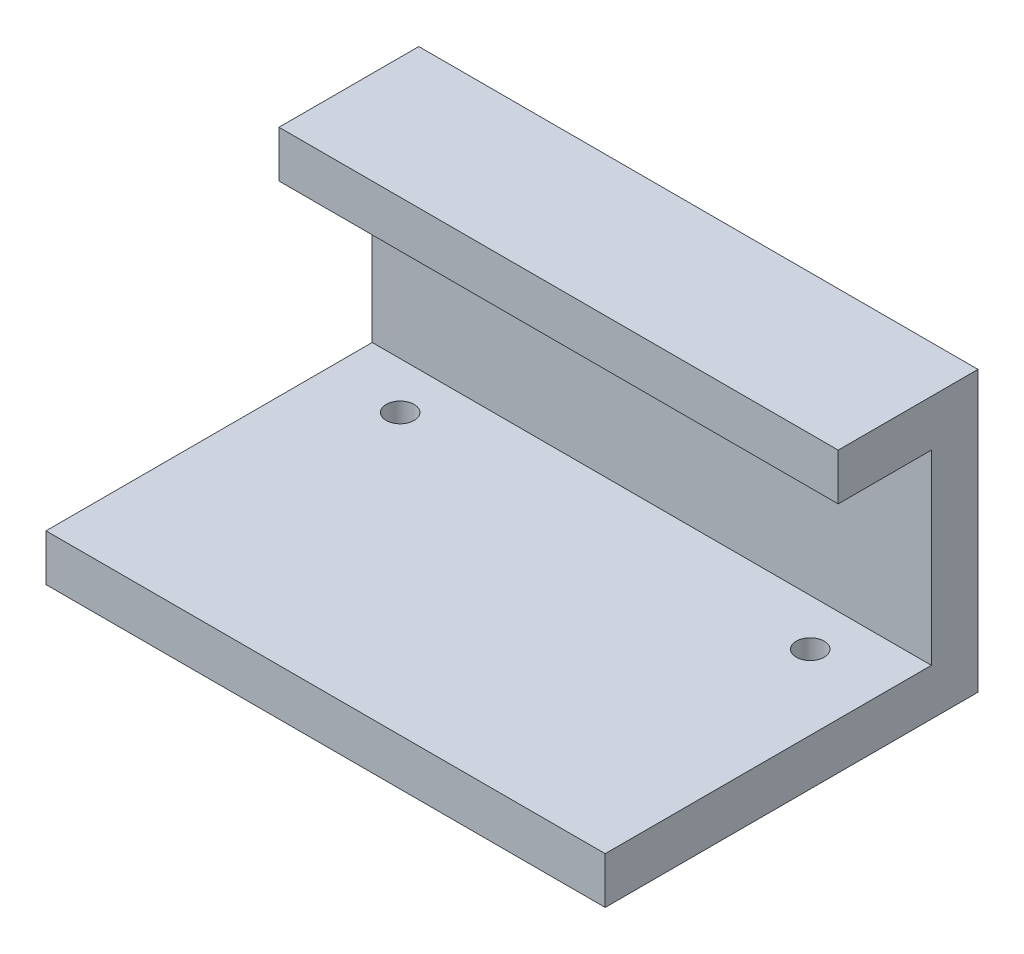
from build123d import *

# Parameters (mm, degrees)
SKETCH_1_W          = 60
SKETCH_1_H          = 40
EXTRUDE_1_DEPTH     = 5
SKETCH_3_W          = 60
SKETCH_3_H          = 5
EXTRUDE_2_DEPTH     = 25
SKETCH_4_W          = 60
SKETCH_4_H          = 5
EXTRUDE_3_DEPTH     = 10
SKETCH_5_R          = 1.5
CUT_EXTRUDE_1_DEPTH = 5


with BuildPart() as part:
    # Эскиз1 → Бобышка-Вытянуть1 (new body)
    with BuildSketch(Plane(origin=(0, 0, 0), x_dir=(1, 0, 0), z_dir=(0, 1, 0))):
        Rectangle(SKETCH_1_W, SKETCH_1_H)
    extrude(amount=EXTRUDE_1_DEPTH)

    # Эскиз3 → Бобышка-Вытянуть2 (add)
    with BuildSketch(Plane(origin=(0, 5, 0), x_dir=(1, 0, 0), z_dir=(0, 1, 0))):
        with Locations((0, 17.5)):
            Rectangle(SKETCH_3_W, SKETCH_3_H)
    extrude(amount=EXTRUDE_2_DEPTH)

    # Эскиз4 → Бобышка-Вытянуть3 (add)
    with BuildSketch(Plane.XY.offset(-15)):
        with Locations((0, 27.5)):
            Rectangle(SKETCH_4_W, SKETCH_4_H)
    extrude(amount=EXTRUDE_3_DEPTH)

    # Эскиз5 → Вырез-Вытянуть1 (cut)
    with BuildSketch(Plane.XZ):
        with Locations(Location((22, -10, 0), (0, 0, 270))):
            Circle(SKETCH_5_R)
        with Locations(Location((-22, -10, 0), (0, 0, 270))):
            Circle(SKETCH_5_R)
    extrude(amount=-CUT_EXTRUDE_1_DEPTH, mode=Mode.SUBTRACT)


solid = part.part
